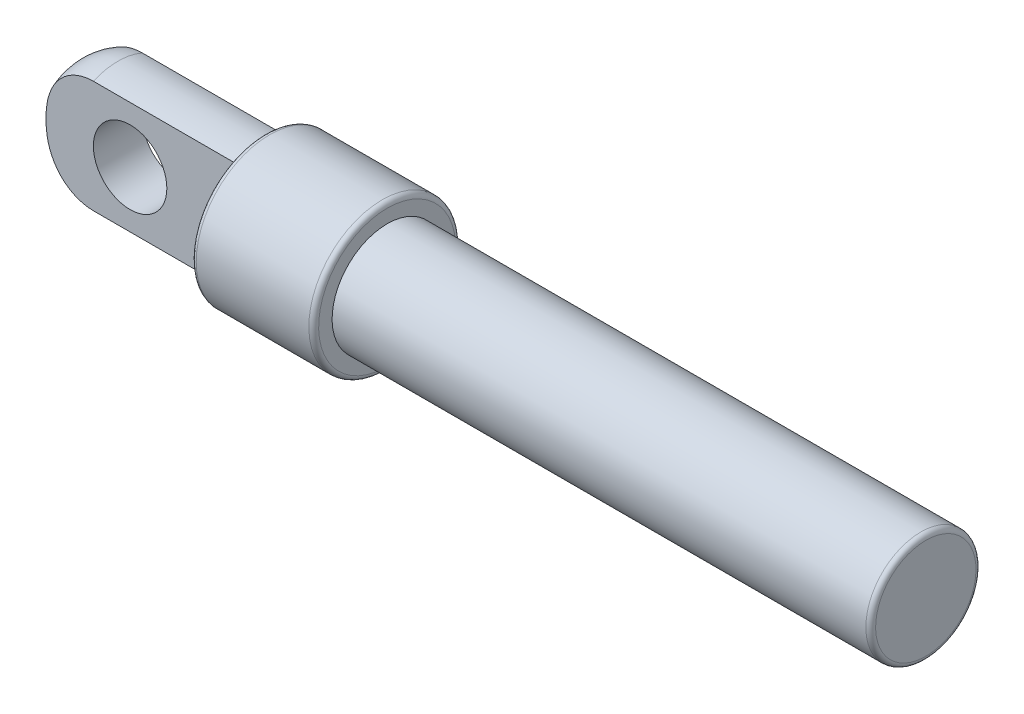
from build123d import *

# Parameters (mm, degrees)
FILLET_1_R          = 2
SKETCH_2_R          = 7.321356554
SKETCH_2_W          = 2
SKETCH_2_H          = 11.961651185
CUT_EXTRUDE_1_DEPTH = 8
SKETCH_3_R          = 1.5
CUT_EXTRUDE_2_DEPTH = 2
FILLET_2_R          = 0.2


with BuildPart() as part:
    # 草图1 → 旋转1 (revolve)
    with BuildSketch(Plane.XY):
        Polygon((0, 0), (0, 2.25), (-22, 2.25), (-22, 3), (-27, 3), (-27, 2.5), (-35, 2.5), (-35, 0), align=None)
    revolve(axis=Axis((0, 0, 0), (-1, 0, 0)))

    # 圆角1
    fillet_1_edges = [part.edges().sort_by_distance(p)[0] for p in [
        (-35, -2.5, 0),
    ]]
    fillet(fillet_1_edges, radius=FILLET_1_R)

    # 草图2 → 切除-拉伸1 (cut)
    with BuildSketch(Plane.ZY.offset(35)):
        Circle(SKETCH_2_R)
        with Locations((0, -0.178000761)):
            Rectangle(SKETCH_2_W, SKETCH_2_H, mode=Mode.SUBTRACT)
    extrude(amount=-CUT_EXTRUDE_1_DEPTH, mode=Mode.SUBTRACT)

    # 草图3 → 切除-拉伸2 (cut)
    with BuildSketch(Plane(origin=(0, 0, -1), x_dir=(-1, 0, 0), z_dir=(0, 0, -1))):
        with Locations(Location((31.5, 0, 0), (0, 0, 90))):
            Circle(SKETCH_3_R)
    extrude(amount=-CUT_EXTRUDE_2_DEPTH, mode=Mode.SUBTRACT)

    # 圆角2
    fillet_2_edges = [part.edges().sort_by_distance(p)[0] for p in [
        (-27, -3, 0),
        (-22, -3, 0),
        (0, -2.25, 0),
    ]]
    fillet(fillet_2_edges, radius=FILLET_2_R)


solid = part.part
